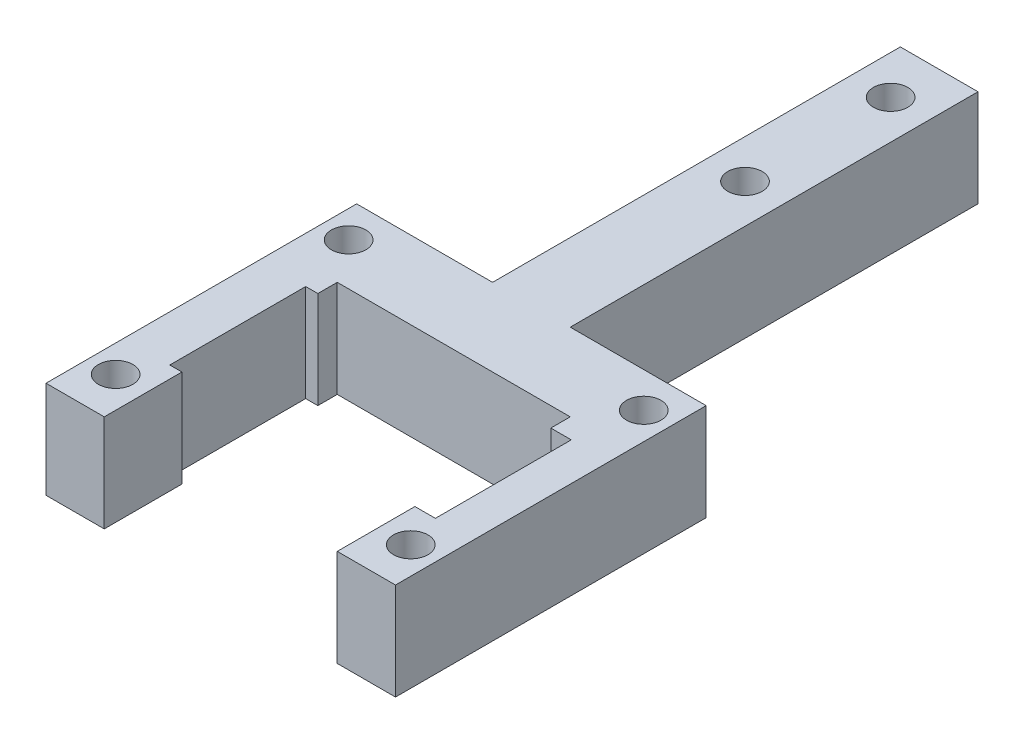
from build123d import *

# Parameters (mm, degrees)
BOSS_EXTRUDE1_DEPTH = 10
SKETCH2_R           = 1.775
CUT_EXTRUDE1_DEPTH  = 68.967856728
SKETCH3_R           = 1.775
CUT_EXTRUDE2_DEPTH  = 68.967856728
SKETCH4_W           = 1.25
SKETCH4_H           = 14
SKETCH4_W_2         = 2.106329952
CUT_EXTRUDE3_DEPTH  = 68.967856728


with BuildPart() as part:
    # Sketch1 → Boss-Extrude1 (new body)
    with BuildSketch(Plane(origin=(0, 0, 0), x_dir=(1, 0, 0), z_dir=(0, 1, 0))):
        Polygon((-4, 64.77367944), (4, 64.77367944), (4, 22.77367944), (18, 22.77367944), (18, -9.22632056), (12, -9.22632056), (12, 14.77367944), (-12, 14.77367944), (-12, -9.22632056), (-18, -9.22632056), (-18, 22.77367944), (-4, 22.77367944), align=None)
    extrude(amount=BOSS_EXTRUDE1_DEPTH)

    # Sketch2 → Cut-Extrude1 (cut, through all)
    with BuildSketch(Plane(origin=(0, 10, 0), x_dir=(1, 0, 0), z_dir=(0, 1, 0))):
        with Locations(Location((0, 44.77367944, 0), (0, 0, 270))):
            Circle(SKETCH2_R)
        with Locations(Location((0, 59.77367944, 0), (0, 0, 270))):
            Circle(SKETCH2_R)
    extrude(amount=-CUT_EXTRUDE1_DEPTH, mode=Mode.SUBTRACT)

    # Sketch3 → Cut-Extrude2 (cut, through all)
    with BuildSketch(Plane(origin=(0, 10, 0), x_dir=(1, 0, 0), z_dir=(0, 1, 0))):
        with Locations(Location((-15.2, -4.855416268, 0), (0, 0, 270))):
            Circle(SKETCH3_R)
        with Locations(Location((15.2, -4.855416268, 0), (0, 0, 270))):
            Circle(SKETCH3_R)
        with Locations(Location((-15.2, 19.144583732, 0), (0, 0, 270))):
            Circle(SKETCH3_R)
        with Locations(Location((15.2, 19.144583732, 0), (0, 0, 270))):
            Circle(SKETCH3_R)
    extrude(amount=-CUT_EXTRUDE2_DEPTH, mode=Mode.SUBTRACT)

    # Sketch4 → Cut-Extrude3 (cut, through all)
    with BuildSketch(Plane(origin=(0, 10, 0), x_dir=(1, 0, 0), z_dir=(0, 1, 0))):
        with Locations((-12.625, 5.77367944)):
            Rectangle(SKETCH4_W, SKETCH4_H)
        with Locations((13.053164976, 5.77367944)):
            Rectangle(SKETCH4_W_2, SKETCH4_H)
    extrude(amount=-CUT_EXTRUDE3_DEPTH, mode=Mode.SUBTRACT)


solid = part.part
